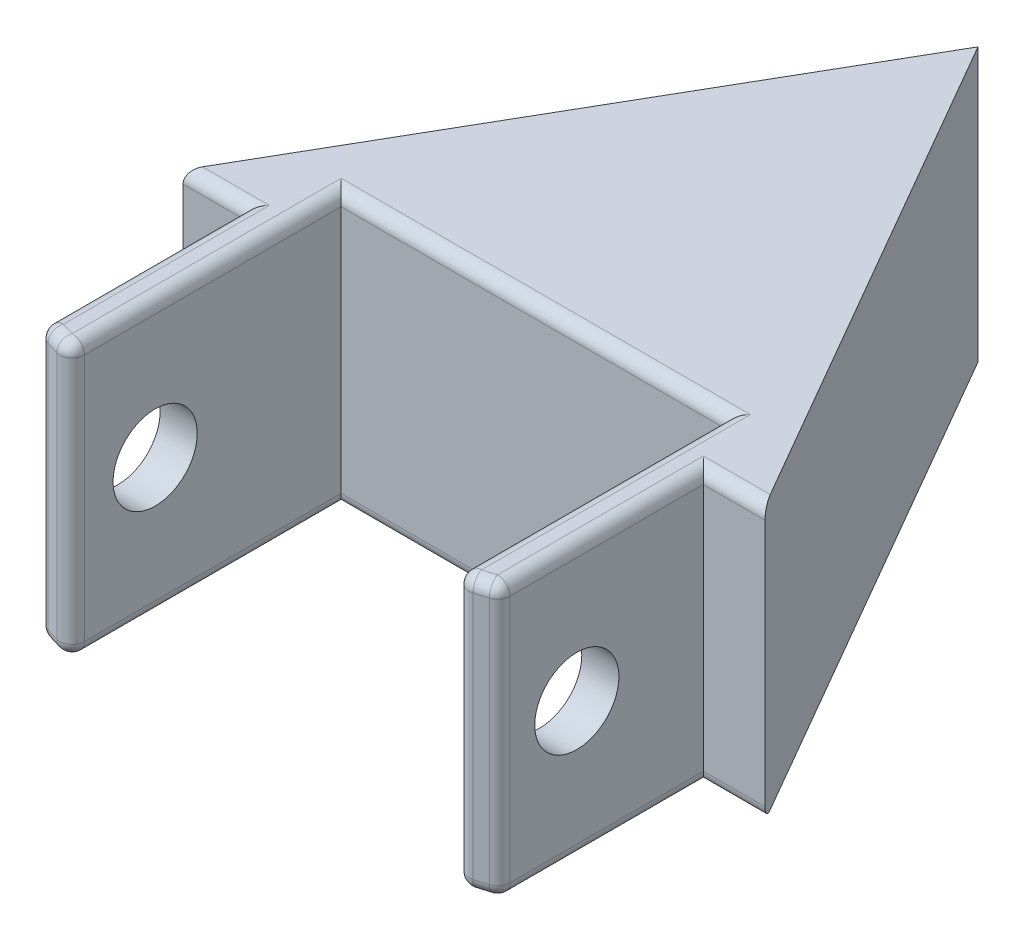
from build123d import *

# Parameters (mm, degrees)
BOSS_EXTRUDE1_DEPTH = 28
CUT_EXTRUDE1_DEPTH  = 90.677477663
SKETCH5_R           = 6.35
CUT_EXTRUDE2_DEPTH  = 4.572
SKETCH8_R           = 6.35
SKETCH8_R_2         = 4.318
BOSS_EXTRUDE4_DEPTH = 6.858
CUT_EXTRUDE6_START  = -2.54
SKETCH13_W          = 36.221601717
SKETCH13_H          = 27.797973411
CUT_EXTRUDE6_DEPTH  = 91.021953984
FILLET3_R           = 1.27


with BuildPart() as part:
    # Sketch2 → Boss-Extrude1 (new body)
    with BuildSketch(Plane(origin=(0, 0, 0), x_dir=(1, 0, 0), z_dir=(0, 1, 0))):
        with BuildLine():
            Line((-38.1, -65.991135768), (0, 0))
            Line((0, 0), (0, -76.2))
            ThreePointArc((0, -76.2), (-19.722011237, -73.603547963), (-38.1, -65.991135768))
        make_face()
    boss_extrude1 = extrude(amount=BOSS_EXTRUDE1_DEPTH)

    # Sketch4 → Cut-Extrude1 (cut, symmetric)
    with BuildSketch(Plane(origin=(0, 28, 0), x_dir=(1, 0, 0), z_dir=(0, 1, 0))):
        Polygon((-19.722011237, -73.603547963), (-19.722011237, -45.603553163), (19.722011237, -45.603553163), (19.722011237, -73.603547963), (19.722011237, -89.083413221), (-19.722011237, -89.083413221), align=None)
    cut_extrude1 = extrude(amount=CUT_EXTRUDE1_DEPTH, both=True, mode=Mode.SUBTRACT)

    # Sketch5 → Cut-Extrude2 (cut)
    with BuildSketch(Plane(origin=(-19.722011237, 0, 0), x_dir=(0, 0, -1), z_dir=(1, 0, 0))):
        with Locations((-64.683550563, 14)):
            Circle(SKETCH5_R)
    cut_extrude2 = extrude(amount=-CUT_EXTRUDE2_DEPTH, mode=Mode.SUBTRACT)

    # Sketch8 → Boss-Extrude4 (add)
    with BuildSketch(Plane(origin=(-19.722011237, 0, 0), x_dir=(0, 0, -1), z_dir=(1, 0, 0))):
        with Locations((-64.683550563, 14)):
            Circle(SKETCH8_R)
        with Locations((-64.683550563, 14)):
            Circle(SKETCH8_R_2, mode=Mode.SUBTRACT)
    boss_extrude4 = extrude(amount=-BOSS_EXTRUDE4_DEPTH)

    # Sketch13 → Cut-Extrude6 (cut)
    with BuildSketch(Plane(origin=(0, 0, 0), x_dir=(1, 0, 0), z_dir=(0, 1, 0)).offset(CUT_EXTRUDE6_START)):
        with Locations((-41.642812096, -65.599005435)):
            Rectangle(SKETCH13_W, SKETCH13_H)
    cut_extrude6 = extrude(amount=CUT_EXTRUDE6_DEPTH, mode=Mode.SUBTRACT)

    # Mirror1: Boss-Extrude1, Cut-Extrude1, Cut-Extrude2, Boss-Extrude4, Cut-Extrude6 across plane
    add(boss_extrude1.mirror(Plane(origin=(0, 28, 0), x_dir=(0, 0, 1), z_dir=(-1, 0, 0))))
    add(cut_extrude1.mirror(Plane(origin=(0, 28, 0), x_dir=(0, 0, 1), z_dir=(-1, 0, 0))), mode=Mode.SUBTRACT)
    add(cut_extrude2.mirror(Plane(origin=(0, 28, 0), x_dir=(0, 0, 1), z_dir=(-1, 0, 0))), mode=Mode.SUBTRACT)
    add(boss_extrude4.mirror(Plane(origin=(0, 28, 0), x_dir=(0, 0, 1), z_dir=(-1, 0, 0))))
    add(cut_extrude6.mirror(Plane(origin=(0, 28, 0), x_dir=(0, 0, 1), z_dir=(-1, 0, 0))), mode=Mode.SUBTRACT)

    # Fillet3
    fillet3_edges = [part.edges().sort_by_distance(p)[0] for p in [
        (21.634365977, 28, 73.064315564),
        (21.634365977, 0, 73.064315564),
        (26.690515484, 0, 51.700018729),
        (0, 0, 45.603553163),
        (23.532011237, 14, 72.475405809),
        (23.532011237, 0, 62.087712269),
        (23.532011237, 28, 62.087712269),
        (26.690515484, 28, 51.700018729),
        (-19.722011237, 0, 59.603550563),
        (-19.722011237, 14, 73.603547963),
        (-19.722011237, 28, 59.603550563),
        (0, 28, 45.603553163),
        (-21.634365977, 0, 73.064315564),
        (-26.690515484, 0, 51.700018729),
        (-21.634365977, 28, 73.064315564),
        (-26.690515484, 28, 51.700018729),
        (-23.532011237, 28, 62.087712269),
        (-23.532011237, 0, 62.087712269),
        (-23.532011237, 14, 72.475405809),
        (19.722011237, 14, 73.603547963),
        (19.722011237, 28, 59.603550563),
        (19.722011237, 0, 59.603550563),
    ]]
    fillet(fillet3_edges, radius=FILLET3_R)


solid = part.part
